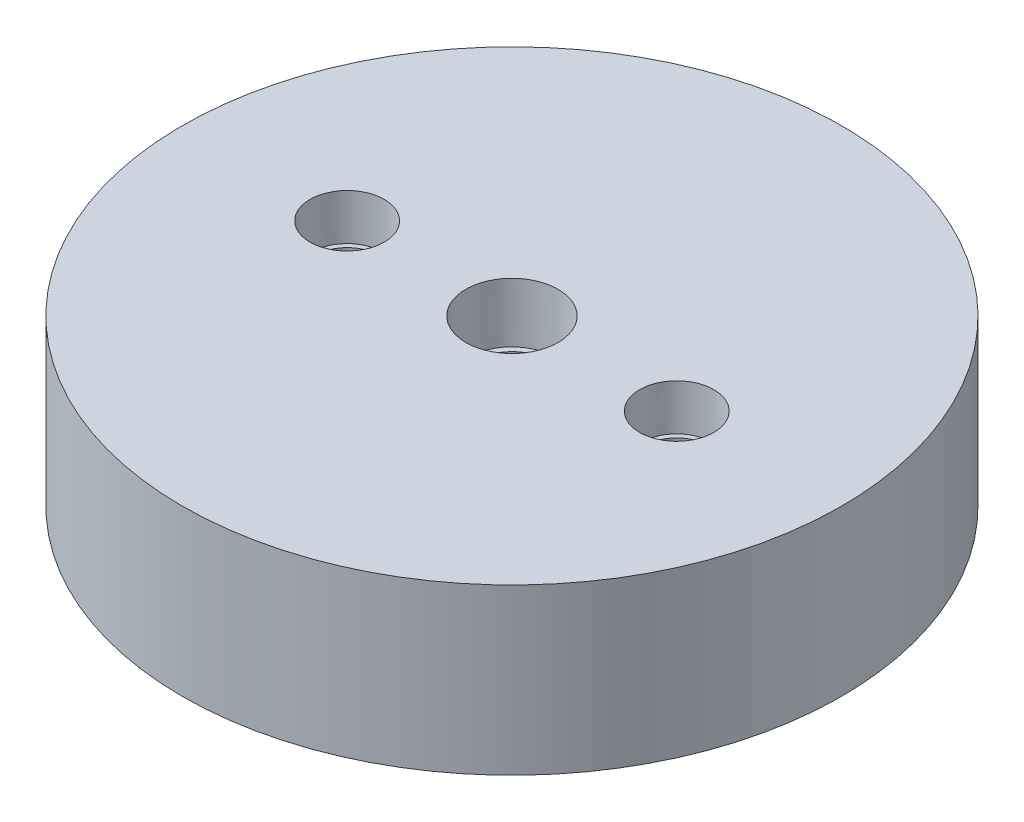
from build123d import *

# Parameters (mm, degrees)
SKETCH1_R                                      = 76.2
BILLET_DEPTH                                   = 50.8
SKETCH3_R                                      = 28.575
LOX_PLATE_DEPTH                                = 17.78
SKETCH5_R                                      = 22.225
LOX_DOME_DEPTH                                 = 4.46278
SKETCH7_R                                      = 76.2
TOP_MILL_DEPTH                                 = 12.7
SKETCH12_R                                     = 60.96
KEROSENE_PLATE_DEPTH                           = 12.7
KEROSENE_INLET_3_8_NPT_TAPPED_HOLE1_AT_2_COUNT = 2
KEROSENE_INLET_3_8_NPT_TAPPED_HOLE1_AT_2_PITCH = 76.2


with BuildPart() as part:
    # Sketch1 → Billet (new body)
    with BuildSketch(Plane(origin=(0, 0, 0), x_dir=(1, 0, 0), z_dir=(0, 1, 0))):
        Circle(SKETCH1_R)
    extrude(amount=-BILLET_DEPTH)

    # Sketch3 → Lox Plate (cut)
    with BuildSketch(Plane(origin=(0, -50.8, 0), x_dir=(1, 0, 0), z_dir=(0, 1, 0))):
        Circle(SKETCH3_R)
    extrude(amount=LOX_PLATE_DEPTH, mode=Mode.SUBTRACT)

    # Sketch5 → Lox Dome (cut)
    with BuildSketch(Plane(origin=(0, -33.02, 0), x_dir=(1, 0, 0), z_dir=(0, 1, 0))):
        Circle(SKETCH5_R)
    extrude(amount=LOX_DOME_DEPTH, mode=Mode.SUBTRACT)

    # Sketch7 → Top Mill (cut)
    with BuildSketch(Plane(origin=(0, 0, 0), x_dir=(1, 0, 0), z_dir=(0, 1, 0))):
        Circle(SKETCH7_R)
    extrude(amount=-TOP_MILL_DEPTH, mode=Mode.SUBTRACT)

    # Sketch12 → Kerosene Plate (cut)
    with BuildSketch(Plane(origin=(0, -50.8, 0), x_dir=(1, 0, 0), z_dir=(0, 1, 0))):
        Circle(SKETCH12_R)
    extrude(amount=KEROSENE_PLATE_DEPTH, mode=Mode.SUBTRACT)

    # Sketch21 → Lox Inlet-1/2 NPT Tapped Hole3 (revolve, cut)
    with BuildSketch(Plane(origin=(0, -12.7, 0), x_dir=(0, 0, 1), z_dir=(1, 0, 0))):
        Polygon((0, 0), (0, 38.1), (8.9281, 38.1), (8.9281, 13.462), (10.261665792, 13.462), (10.6647361, 0), align=None)
    revolve(axis=Axis((0, -6.35, 0), (0, -1, 0)), mode=Mode.SUBTRACT)

    # Sketch25 → Kerosene Inlet-3/8 NPT Tapped Hole1 (revolve, cut)
    with BuildSketch(Plane(origin=(-38.1, -12.7, 0), x_dir=(0, 0, 1), z_dir=(1, 0, 0))):
        Polygon((0, 0), (0, 38.1), (7.1374, 38.1), (7.1374, 10.414), (8.263205494, 10.414), (8.5750146, 0), align=None)
    kerosene_inlet_3_8_npt_tapped_hole1 = revolve(axis=Axis((-38.1, -6.35, 0), (0, -1, 0)), mode=Mode.SUBTRACT)

    # Kerosene Inlet-3/8 NPT Tapped Hole1 at 2: Kerosene Inlet-3/8 NPT Tapped Hole1 ×2
    with Locations(*[(i * KEROSENE_INLET_3_8_NPT_TAPPED_HOLE1_AT_2_PITCH, 0, 0) for i in range(1, KEROSENE_INLET_3_8_NPT_TAPPED_HOLE1_AT_2_COUNT)]):
        add(kerosene_inlet_3_8_npt_tapped_hole1, mode=Mode.SUBTRACT)


solid = part.part
